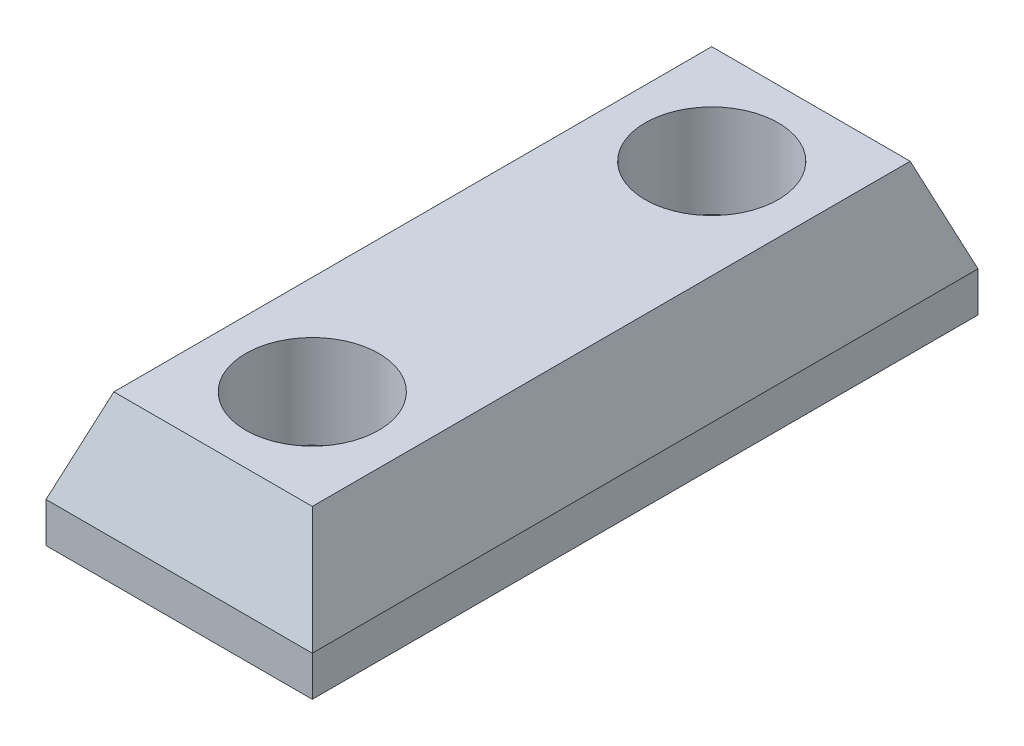
from build123d import *
from OCP.BRepFilletAPI import BRepFilletAPI_MakeChamfer

# Parameters (mm, degrees)
SKETCH1_R             = 5
SKETCH1_R_2           = 2.5
BOSS_EXTRUDE1_DEPTH   = 3
BOSS_EXTRUDE1_2_DEPTH = 3
SKETCH1_3_W           = 20
SKETCH1_3_H           = 50
SKETCH1_3_R           = 5
BOSS_EXTRUDE2_DEPTH   = 10
CHAMFER1_SIZE         = 7
CHAMFER1_SIZE2        = 2.54779164


with BuildPart() as part:
    # Sketch1 → Boss-Extrude1 (new body)
    with BuildSketch(Plane(origin=(0, 0, 0), x_dir=(1, 0, 0), z_dir=(0, 1, 0))):
        with Locations((-10, 40)):
            Circle(SKETCH1_R)
        with Locations((-10, 40)):
            Circle(SKETCH1_R_2, mode=Mode.SUBTRACT)
    extrude(amount=BOSS_EXTRUDE1_DEPTH)



with BuildPart() as body_2:
    # Sketch1 → Boss-Extrude1 2 (new body)
    with BuildSketch(Plane(origin=(0, 0, 0), x_dir=(1, 0, 0), z_dir=(0, 1, 0))):
        with Locations((-10, 10)):
            Circle(SKETCH1_R)
        with Locations((-10, 10)):
            Circle(SKETCH1_R_2, mode=Mode.SUBTRACT)
    extrude(amount=BOSS_EXTRUDE1_2_DEPTH)


with BuildPart() as part_1:
    add(part.part)

    add(body_2.part)  # Boss-Extrude2 merges body 2
    # Sketch1<3> → Boss-Extrude2 (add)
    with BuildSketch(Plane(origin=(0, 0, 0), x_dir=(1, 0, 0), z_dir=(0, 1, 0))):
        with Locations((-10, 25)):
            Rectangle(SKETCH1_3_W, SKETCH1_3_H)
        with Locations((-10, 10)):
            Circle(SKETCH1_3_R, mode=Mode.SUBTRACT)
        with Locations((-10, 40)):
            Circle(SKETCH1_3_R, mode=Mode.SUBTRACT)
    extrude(amount=BOSS_EXTRUDE2_DEPTH)

    # Chamfer1: one chamfer whose edges measure the first distance from different faces: ONE call of the kernel's chamfer builder (chamfer() names one face for all edges)
    chamfer1_edges_1 = [part_1.edges().sort_by_distance(p)[0] for p in [
        (-10, 10, -50),
    ]]
    chamfer1_side_1 = [part_1.faces().sort_by_distance(p)[0] for p in [
        (-10, 5, -50),
    ]]
    chamfer1_edges_2 = [part_1.edges().sort_by_distance(p)[0] for p in [
        (-20, 10, -25),
    ]]
    chamfer1_side_2 = [part_1.faces().sort_by_distance(p)[0] for p in [
        (-20, 5, -25),
    ]]
    chamfer1_edges_3 = [part_1.edges().sort_by_distance(p)[0] for p in [
        (-10, 10, 0),
    ]]
    chamfer1_side_3 = [part_1.faces().sort_by_distance(p)[0] for p in [
        (-10, 5, 0),
    ]]
    chamfer1_edges_4 = [part_1.edges().sort_by_distance(p)[0] for p in [
        (0, 10, -25),
    ]]
    chamfer1_side_4 = [part_1.faces().sort_by_distance(p)[0] for p in [
        (0, 5, -25),
    ]]
    chamfer1 = BRepFilletAPI_MakeChamfer(part_1.part.solid().wrapped)
    for e in chamfer1_edges_1:
        chamfer1.Add(CHAMFER1_SIZE, CHAMFER1_SIZE2, e.wrapped, chamfer1_side_1[0].wrapped)  # the first distance lies on this face
    for e in chamfer1_edges_2:
        chamfer1.Add(CHAMFER1_SIZE, CHAMFER1_SIZE2, e.wrapped, chamfer1_side_2[0].wrapped)  # the first distance lies on this face
    for e in chamfer1_edges_3:
        chamfer1.Add(CHAMFER1_SIZE, CHAMFER1_SIZE2, e.wrapped, chamfer1_side_3[0].wrapped)  # the first distance lies on this face
    for e in chamfer1_edges_4:
        chamfer1.Add(CHAMFER1_SIZE, CHAMFER1_SIZE2, e.wrapped, chamfer1_side_4[0].wrapped)  # the first distance lies on this face
    add(Compound.cast(chamfer1.Shape()), mode=Mode.REPLACE)


solid = part_1.part
